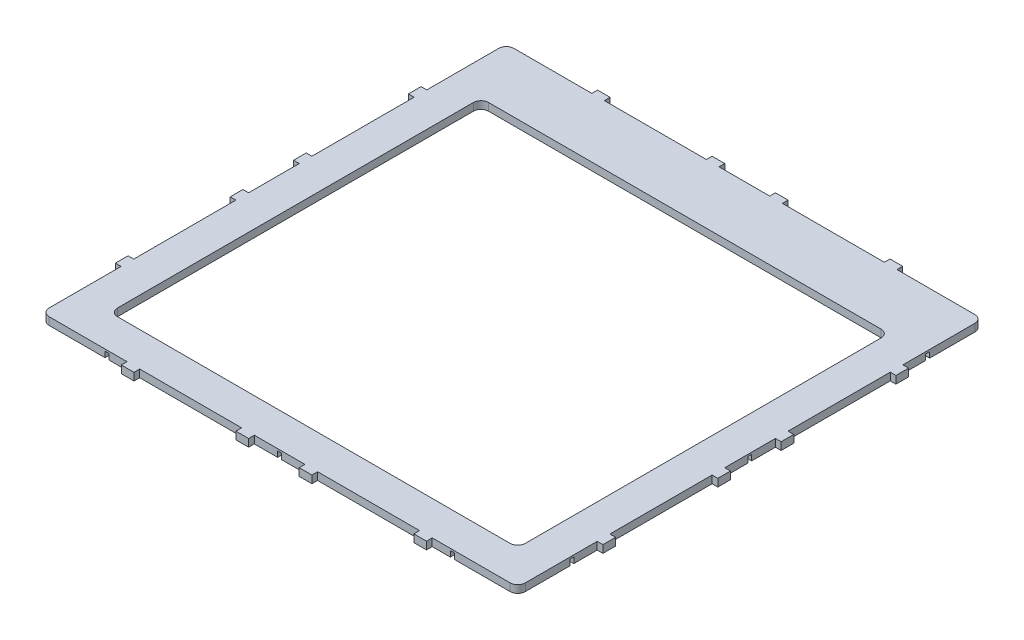
from build123d import *

# Parameters (mm, degrees)
CROQUIS1_R              = 6
SALIENTE_EXTRUIR1_DEPTH = 6
CORTAR_EXTRUIR1_DEPTH   = 4.5
CROQUIS4_W              = 19.689698303
CROQUIS4_H              = 17.939386148
CROQUIS4_W_2            = 19.444542847
SALIENTE_EXTRUIR2_DEPTH = 1.5


with BuildPart() as part:
    # Croquis1 → Saliente-Extruir1 (new body)
    with BuildSketch(Plane(origin=(0, 0, 0), x_dir=(1, 0, 0), z_dir=(0, 1, 0))):
        with BuildLine():
            Line((370, 0), (308.5, 0))
            Line((308.5, 0), (308.5, -4.5))
            Line((308.5, -4.5), (298.5, -4.5))
            Line((298.5, -4.5), (298.5, 0))
            Line((298.5, 0), (218, 0))
            Line((218, 0), (218, -4.5))
            Line((218, -4.5), (208, -4.5))
            Line((208, -4.5), (208, 0))
            Line((208, 0), (168, 0))
            Line((168, 0), (168, -4.5))
            Line((168, -4.5), (158, -4.5))
            Line((158, -4.5), (158, 0))
            Line((158, 0), (77.5, 0))
            Line((77.5, 0), (77.5, -4.5))
            Line((77.5, -4.5), (67.5, -4.5))
            Line((67.5, -4.5), (67.5, 0))
            Line((67.5, 0), (6, 0))
            ThreePointArc((6, 0), (1.757359313, 1.757359313), (0, 6))
            Line((0, 6), (0, 62.8))
            Line((0, 62.8), (-4.5, 62.8))
            Line((-4.5, 62.8), (-4.5, 72.8))
            Line((-4.5, 72.8), (0, 72.8))
            Line((0, 72.8), (0, 153.5))
            Line((0, 153.5), (-4.5, 153.5))
            Line((-4.5, 153.5), (-4.5, 163.5))
            Line((-4.5, 163.5), (0, 163.5))
            Line((0, 163.5), (0, 203.5))
            Line((0, 203.5), (-4.5, 203.5))
            Line((-4.5, 203.5), (-4.5, 213.5))
            Line((-4.5, 213.5), (0, 213.5))
            Line((0, 213.5), (0, 294.2))
            Line((0, 294.2), (-4.5, 294.2))
            Line((-4.5, 294.2), (-4.5, 304.2))
            Line((-4.5, 304.2), (0, 304.2))
            Line((0, 304.2), (0, 361))
            ThreePointArc((0, 361), (1.757359313, 365.242640687), (6, 367))
            Line((6, 367), (67.5, 367))
            Line((67.5, 367), (67.5, 371.5))
            Line((67.5, 371.5), (77.5, 371.5))
            Line((77.5, 371.5), (77.5, 367))
            Line((77.5, 367), (158, 367))
            Line((158, 367), (158, 371.5))
            Line((158, 371.5), (168, 371.5))
            Line((168, 371.5), (168, 367))
            Line((168, 367), (208, 367))
            Line((208, 367), (208, 371.5))
            Line((208, 371.5), (218, 371.5))
            Line((218, 371.5), (218, 367))
            Line((218, 367), (298.5, 367))
            Line((298.5, 367), (298.5, 371.5))
            Line((298.5, 371.5), (308.5, 371.5))
            Line((308.5, 371.5), (308.5, 367))
            Line((308.5, 367), (370, 367))
            ThreePointArc((370, 367), (374.242640687, 365.242640687), (376, 361))
            Line((376, 361), (376, 304.2))
            Line((376, 304.2), (380.5, 304.2))
            Line((380.5, 304.2), (380.5, 294.2))
            Line((380.5, 294.2), (376, 294.2))
            Line((376, 294.2), (376, 213.5))
            Line((376, 213.5), (380.5, 213.5))
            Line((380.5, 213.5), (380.5, 203.5))
            Line((380.5, 203.5), (376, 203.5))
            Line((376, 203.5), (376, 163.5))
            Line((376, 163.5), (380.5, 163.5))
            Line((380.5, 163.5), (380.5, 153.5))
            Line((380.5, 153.5), (376, 153.5))
            Line((376, 153.5), (376, 72.8))
            Line((376, 72.8), (380.5, 72.8))
            Line((380.5, 72.8), (380.5, 62.8))
            Line((380.5, 62.8), (376, 62.8))
            Line((376, 62.8), (376, 6))
            ThreePointArc((376, 6), (374.242640687, 1.757359313), (370, 0))
        make_face()
        with Locations(Location((283, 346, 0), (0, 0, 270))):
            Circle(CROQUIS1_R, mode=Mode.SUBTRACT)
        with Locations(Location((93, 346, 0), (0, 0, 270))):
            Circle(CROQUIS1_R, mode=Mode.SUBTRACT)
        with BuildLine():
            Line((349, 313.979406582), (349, 33))
            ThreePointArc((349, 33), (347.242640687, 28.757359313), (343, 27))
            Line((343, 27), (33, 27))
            ThreePointArc((33, 27), (28.757359313, 28.757359313), (27, 33))
            Line((27, 33), (27, 313.958112531))
            ThreePointArc((27, 313.958112531), (28.769627868, 318.230372132), (33.041887469, 320))
            Line((33.041887469, 320), (342.979406582, 320))
            ThreePointArc((342.979406582, 320), (347.236609015, 318.236609015), (349, 313.979406582))
        make_face(mode=Mode.SUBTRACT)
    extrude(amount=-SALIENTE_EXTRUIR1_DEPTH)

    # Croquis3 → Cortar-Extruir1 (cut)
    with BuildSketch(Plane.XZ.offset(6)):
        with BuildLine():
            Line((322.801879925, 0), (325.901879925, 0))
            Line((325.901879925, 0), (325.901879925, -6.500225243))
            ThreePointArc((325.901879925, -6.500225243), (326.82648456, -7.028314779), (327.192217556, -8.028320611))
            Line((327.192217556, -8.028320611), (327.192217556, -9.578320611))
            ThreePointArc((327.192217556, -9.578320611), (327.004452384, -10.317790877), (326.486648169, -10.878104031))
            Line((326.486648169, -10.878104031), (326.317403237, -10.878104031))
            ThreePointArc((326.317403237, -10.878104031), (324.351879925, -12.24449376), (322.386356613, -10.878104031))
            Line((322.386356613, -10.878104031), (322.217111681, -10.878104031))
            ThreePointArc((322.217111681, -10.878104031), (321.699307467, -10.317790877), (321.511542294, -9.578320611))
            Line((321.511542294, -9.578320611), (321.511542294, -8.028320611))
            ThreePointArc((321.511542294, -8.028320611), (321.87727529, -7.028314779), (322.801879925, -6.500225243))
            Line((322.801879925, -6.500225243), (322.801879925, 0))
        make_face()
        with BuildLine():
            Line((53.784768244, -356.121895969), (53.615523312, -356.121895969))
            ThreePointArc((53.615523312, -356.121895969), (51.65, -354.75550624), (49.684476688, -356.121895969))
            Line((49.684476688, -356.121895969), (49.515231756, -356.121895969))
            ThreePointArc((49.515231756, -356.121895969), (48.997427542, -356.682209123), (48.809662369, -357.421679389))
            Line((48.809662369, -357.421679389), (48.809662369, -358.971679389))
            ThreePointArc((48.809662369, -358.971679389), (49.175395365, -359.971685221), (50.1, -360.499774757))
            Line((50.1, -360.499774757), (50.1, -367))
            Line((50.1, -367), (53.2, -367))
            Line((53.2, -367), (53.2, -360.499774757))
            ThreePointArc((53.2, -360.499774757), (54.124604635, -359.971685221), (54.490337631, -358.971679389))
            Line((54.490337631, -358.971679389), (54.490337631, -357.421679389))
            ThreePointArc((54.490337631, -357.421679389), (54.302572458, -356.682209123), (53.784768244, -356.121895969))
        make_face()
        with BuildLine():
            Line((190.134768244, -356.121895969), (189.965523312, -356.121895969))
            ThreePointArc((189.965523312, -356.121895969), (188, -354.75550624), (186.034476688, -356.121895969))
            Line((186.034476688, -356.121895969), (185.865231756, -356.121895969))
            ThreePointArc((185.865231756, -356.121895969), (185.347427542, -356.682209123), (185.159662369, -357.421679389))
            Line((185.159662369, -357.421679389), (185.159662369, -358.971679389))
            ThreePointArc((185.159662369, -358.971679389), (185.525395365, -359.971685221), (186.45, -360.499774757))
            Line((186.45, -360.499774757), (186.45, -367))
            Line((186.45, -367), (189.55, -367))
            Line((189.55, -367), (189.55, -360.499774757))
            ThreePointArc((189.55, -360.499774757), (190.474604635, -359.971685221), (190.840337631, -358.971679389))
            Line((190.840337631, -358.971679389), (190.840337631, -357.421679389))
            ThreePointArc((190.840337631, -357.421679389), (190.652572458, -356.682209123), (190.134768244, -356.121895969))
        make_face()
        with BuildLine():
            Line((6.500225243, -44.4), (0, -44.4))
            Line((0, -44.4), (0, -41.3))
            Line((0, -41.3), (6.500225243, -41.3))
            ThreePointArc((6.500225243, -41.3), (7.028314779, -40.375395365), (8.028320611, -40.009662369))
            Line((8.028320611, -40.009662369), (9.578320611, -40.009662369))
            ThreePointArc((9.578320611, -40.009662369), (10.317790877, -40.197427542), (10.878104031, -40.715231756))
            Line((10.878104031, -40.715231756), (10.878104031, -40.884476688))
            ThreePointArc((10.878104031, -40.884476688), (12.24449376, -42.85), (10.878104031, -44.815523312))
            Line((10.878104031, -44.815523312), (10.878104031, -44.984768244))
            ThreePointArc((10.878104031, -44.984768244), (10.317790877, -45.502572458), (9.578320611, -45.690337631))
            Line((9.578320611, -45.690337631), (8.028320611, -45.690337631))
            ThreePointArc((8.028320611, -45.690337631), (7.028314779, -45.324604635), (6.500225243, -44.4))
        make_face()
        with BuildLine():
            Line((10.878104031, -185.534768244), (10.878104031, -185.365523312))
            ThreePointArc((10.878104031, -185.365523312), (12.24449376, -183.4), (10.878104031, -181.434476688))
            Line((10.878104031, -181.434476688), (10.878104031, -181.265231756))
            ThreePointArc((10.878104031, -181.265231756), (10.317790877, -180.747427542), (9.578320611, -180.559662369))
            Line((9.578320611, -180.559662369), (8.028320611, -180.559662369))
            ThreePointArc((8.028320611, -180.559662369), (7.028314779, -180.925395365), (6.500225243, -181.85))
            Line((6.500225243, -181.85), (0, -181.85))
            Line((0, -181.85), (0, -184.95))
            Line((0, -184.95), (6.500225243, -184.95))
            ThreePointArc((6.500225243, -184.95), (7.028314779, -185.874604635), (8.028320611, -186.240337631))
            Line((8.028320611, -186.240337631), (9.578320611, -186.240337631))
            ThreePointArc((9.578320611, -186.240337631), (10.317790877, -186.052572458), (10.878104031, -185.534768244))
        make_face()
        with BuildLine():
            Line((10.878104031, -321.750111483), (10.878104031, -321.919356416))
            ThreePointArc((10.878104031, -321.919356416), (12.24449376, -323.884879727), (10.878104031, -325.850403039))
            Line((10.878104031, -325.850403039), (10.878104031, -326.019647971))
            ThreePointArc((10.878104031, -326.019647971), (10.317790877, -326.537452186), (9.578320611, -326.725217358))
            Line((9.578320611, -326.725217358), (8.028320611, -326.725217358))
            ThreePointArc((8.028320611, -326.725217358), (7.028314779, -326.359484362), (6.500225243, -325.434879727))
            Line((6.500225243, -325.434879727), (0, -325.434879727))
            Line((0, -325.434879727), (0, -322.334879727))
            Line((0, -322.334879727), (6.500225243, -322.334879727))
            ThreePointArc((6.500225243, -322.334879727), (7.028314779, -321.410275093), (8.028320611, -321.044542096))
            Line((8.028320611, -321.044542096), (9.578320611, -321.044542096))
            ThreePointArc((9.578320611, -321.044542096), (10.317790877, -321.232307269), (10.878104031, -321.750111483))
        make_face()
        with BuildLine():
            Line((369.499774757, -322.15), (376, -322.15))
            Line((376, -322.15), (376, -325.25))
            Line((376, -325.25), (369.499774757, -325.25))
            ThreePointArc((369.499774757, -325.25), (368.971685221, -326.174604635), (367.971679389, -326.540337631))
            Line((367.971679389, -326.540337631), (366.421679389, -326.540337631))
            ThreePointArc((366.421679389, -326.540337631), (365.682209123, -326.352572458), (365.121895969, -325.834768244))
            Line((365.121895969, -325.834768244), (365.121895969, -325.665523312))
            ThreePointArc((365.121895969, -325.665523312), (363.75550624, -323.7), (365.121895969, -321.734476688))
            Line((365.121895969, -321.734476688), (365.121895969, -321.565231756))
            ThreePointArc((365.121895969, -321.565231756), (365.682209123, -321.047427542), (366.421679389, -320.859662369))
            Line((366.421679389, -320.859662369), (367.971679389, -320.859662369))
            ThreePointArc((367.971679389, -320.859662369), (368.971685221, -321.225395365), (369.499774757, -322.15))
        make_face()
        with BuildLine():
            Line((367.971679389, -180.373855212), (366.421679389, -180.373855212))
            ThreePointArc((366.421679389, -180.373855212), (365.682209123, -180.561620384), (365.121895969, -181.079424598))
            Line((365.121895969, -181.079424598), (365.121895969, -181.248669531))
            ThreePointArc((365.121895969, -181.248669531), (363.75550624, -183.214192843), (365.121895969, -185.179716154))
            Line((365.121895969, -185.179716154), (365.121895969, -185.348961087))
            ThreePointArc((365.121895969, -185.348961087), (365.682209123, -185.866765301), (366.421679389, -186.054530474))
            Line((366.421679389, -186.054530474), (367.971679389, -186.054530474))
            ThreePointArc((367.971679389, -186.054530474), (368.971685221, -185.688797477), (369.499774757, -184.764192843))
            Line((369.499774757, -184.764192843), (376, -184.764192843))
            Line((376, -184.764192843), (376, -181.664192843))
            Line((376, -181.664192843), (369.499774757, -181.664192843))
            ThreePointArc((369.499774757, -181.664192843), (368.971685221, -180.739588208), (367.971679389, -180.373855212))
        make_face()
        with BuildLine():
            Line((365.121895969, -44.862745577), (365.121895969, -44.693500644))
            ThreePointArc((365.121895969, -44.693500644), (363.75550624, -42.727977333), (365.121895969, -40.762454021))
            Line((365.121895969, -40.762454021), (365.121895969, -40.593209088))
            ThreePointArc((365.121895969, -40.593209088), (365.682209123, -40.075404874), (366.421679389, -39.887639702))
            Line((366.421679389, -39.887639702), (367.971679389, -39.887639702))
            ThreePointArc((367.971679389, -39.887639702), (368.971685221, -40.253372698), (369.499774757, -41.177977333))
            Line((369.499774757, -41.177977333), (376, -41.177977333))
            Line((376, -41.177977333), (376, -44.277977333))
            Line((376, -44.277977333), (369.499774757, -44.277977333))
            ThreePointArc((369.499774757, -44.277977333), (368.971685221, -45.202581967), (367.971679389, -45.568314963))
            Line((367.971679389, -45.568314963), (366.421679389, -45.568314963))
            ThreePointArc((366.421679389, -45.568314963), (365.682209123, -45.380549791), (365.121895969, -44.862745577))
        make_face()
        with BuildLine():
            Line((50.1, 0), (53.2, 0))
            Line((53.2, 0), (53.2, -6.500225243))
            ThreePointArc((53.2, -6.500225243), (54.124604635, -7.028314779), (54.490337631, -8.028320611))
            Line((54.490337631, -8.028320611), (54.490337631, -9.578320611))
            ThreePointArc((54.490337631, -9.578320611), (54.302572458, -10.317790877), (53.784768244, -10.878104031))
            Line((53.784768244, -10.878104031), (53.615523312, -10.878104031))
            ThreePointArc((53.615523312, -10.878104031), (51.65, -12.24449376), (49.684476688, -10.878104031))
            Line((49.684476688, -10.878104031), (49.515231756, -10.878104031))
            ThreePointArc((49.515231756, -10.878104031), (48.997427542, -10.317790877), (48.809662369, -9.578320611))
            Line((48.809662369, -9.578320611), (48.809662369, -8.028320611))
            ThreePointArc((48.809662369, -8.028320611), (49.175395365, -7.028314779), (50.1, -6.500225243))
            Line((50.1, -6.500225243), (50.1, 0))
        make_face()
        with BuildLine():
            Line((326.486648169, -356.121895969), (326.317403237, -356.121895969))
            ThreePointArc((326.317403237, -356.121895969), (324.351879925, -354.75550624), (322.386356613, -356.121895969))
            Line((322.386356613, -356.121895969), (322.217111681, -356.121895969))
            ThreePointArc((322.217111681, -356.121895969), (321.699307467, -356.682209123), (321.511542294, -357.421679389))
            Line((321.511542294, -357.421679389), (321.511542294, -358.971679389))
            ThreePointArc((321.511542294, -358.971679389), (321.87727529, -359.971685221), (322.801879925, -360.499774757))
            Line((322.801879925, -360.499774757), (322.801879925, -367))
            Line((322.801879925, -367), (325.901879925, -367))
            Line((325.901879925, -367), (325.901879925, -360.499774757))
            ThreePointArc((325.901879925, -360.499774757), (326.82648456, -359.971685221), (327.192217556, -358.971679389))
            Line((327.192217556, -358.971679389), (327.192217556, -357.421679389))
            ThreePointArc((327.192217556, -357.421679389), (327.004452384, -356.682209123), (326.486648169, -356.121895969))
        make_face()
        with BuildLine():
            Line((186.45, 0), (189.55, 0))
            Line((189.55, 0), (189.55, -6.500225243))
            ThreePointArc((189.55, -6.500225243), (190.474604635, -7.028314779), (190.840337631, -8.028320611))
            Line((190.840337631, -8.028320611), (190.840337631, -9.578320611))
            ThreePointArc((190.840337631, -9.578320611), (190.652572458, -10.317790877), (190.134768244, -10.878104031))
            Line((190.134768244, -10.878104031), (189.965523312, -10.878104031))
            ThreePointArc((189.965523312, -10.878104031), (188, -12.24449376), (186.034476688, -10.878104031))
            Line((186.034476688, -10.878104031), (185.865231756, -10.878104031))
            ThreePointArc((185.865231756, -10.878104031), (185.347427542, -10.317790877), (185.159662369, -9.578320611))
            Line((185.159662369, -9.578320611), (185.159662369, -8.028320611))
            ThreePointArc((185.159662369, -8.028320611), (185.525395365, -7.028314779), (186.45, -6.500225243))
            Line((186.45, -6.500225243), (186.45, 0))
        make_face()
    extrude(amount=-CORTAR_EXTRUIR1_DEPTH, mode=Mode.SUBTRACT)

    # Croquis4 → Saliente-Extruir2 (add)
    with BuildSketch(Plane(origin=(0, 0, 0), x_dir=(1, 0, 0), z_dir=(0, 1, 0))):
        with Locations((92.462989416, 345.619306962)):
            Rectangle(CROQUIS4_W, CROQUIS4_H)
        with Locations((282.063135879, 345.619306962)):
            Rectangle(CROQUIS4_W_2, CROQUIS4_H)
    extrude(amount=-SALIENTE_EXTRUIR2_DEPTH)


solid = part.part
